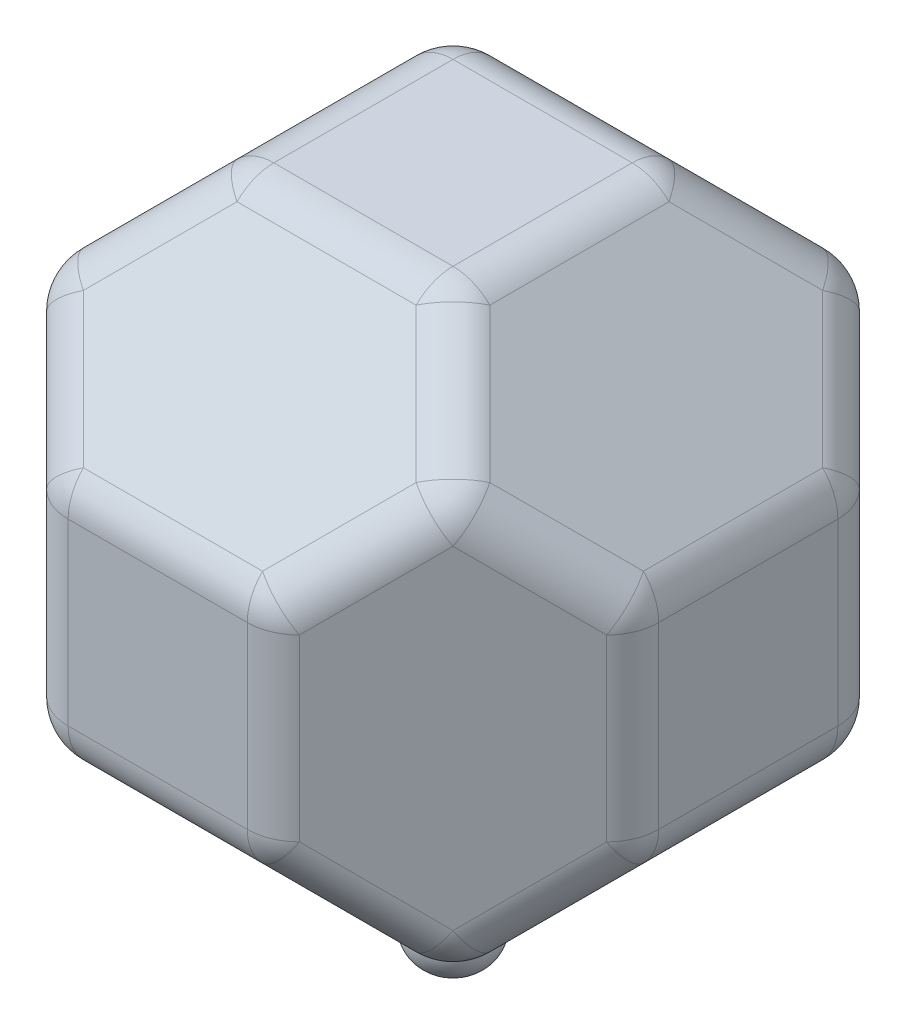
from build123d import *

# Parameters (mm, degrees)
BOSS_EXTRU_1_DEPTH            = 170
ENL_V_MAT_EXTRU_1_DEPTH       = 220
ENL_V_MAT_EXTRU_2_DEPTH       = 220
ENL_V_MAT_EXTRU_3_DEPTH       = 220
ENL_V_MAT_EXTRU_4_DEPTH       = 220
ENL_V_MAT_EXTRU_11_DEPTH      = 220
ENL_V_MAT_EXTRU_13_DEPTH      = 220
ENL_V_MAT_EXTRU_13_DEPTH_BACK = 220
ENL_V_MAT_EXTRU_14_DEPTH      = 220
ENL_V_MAT_EXTRU_15_DEPTH      = 220
ENL_V_MAT_EXTRU_15_DEPTH_BACK = 220
ENL_V_MAT_EXTRU_16_DEPTH      = 220
ENL_V_MAT_EXTRU_17_DEPTH      = 220
ENL_V_MAT_EXTRU_17_DEPTH_BACK = 220
ENL_V_MAT_EXTRU_18_DEPTH      = 220
ENL_V_MAT_EXTRU_19_DEPTH      = 220
ENL_V_MAT_EXTRU_19_DEPTH_BACK = 220
ENL_V_MAT_EXTRU_20_DEPTH      = 220
ENL_V_MAT_EXTRU_20_DEPTH_BACK = 220
ENL_V_MAT_EXTRU_21_DEPTH      = 220
ENL_V_MAT_EXTRU_21_DEPTH_BACK = 220
ENL_V_MAT_EXTRU_22_DEPTH      = 220
ENL_V_MAT_EXTRU_22_DEPTH_BACK = 220
ENL_V_MAT_EXTRU_23_DEPTH      = 220
ENL_V_MAT_EXTRU_23_DEPTH_BACK = 220
CONG_2_R                      = 15
ESQUISSE26_R                  = 11.42194069
BOSS_EXTRU_2_DEPTH            = 30
CONG_6_R                      = 10


with BuildPart() as part:
    # Esquisse1 → Boss.-Extru.1 (new body)
    with BuildSketch(Plane.XY):
        Polygon((-32, 85), (32, 85), (85, 32), (85, -32), (32, -85), (-32, -85), (-85, -32), (-85, 32), align=None)
    extrude(amount=BOSS_EXTRU_1_DEPTH)

    # Esquisse3D3 → Enlèv. mat.-Extru.1 (cut, along a direction that is not the sketch's normal)
    with BuildSketch(Plane(origin=(-32, 85, 117), x_dir=(0.6493531093113899, -0.5377455436484948, 0.5377455436484945), z_dir=(0, 0.7071067811865474, 0.7071067811865478))):
        Polygon((0, 0), (57.001027627, -48.67117062), (98.559626623, 0), (41.558598996, 48.67117062), align=None)
    extrude(amount=ENL_V_MAT_EXTRU_1_DEPTH, dir=(0, 0, 1), mode=Mode.SUBTRACT)

    # Esquisse3D4 → Enlèv. mat.-Extru.2 (cut, along a direction that is not the sketch's normal)
    with BuildSketch(Plane(origin=(32, 85, 53), x_dir=(-0.6493531093113893, -0.537745543648495, -0.537745543648495), z_dir=(0, -0.7071067811865476, 0.7071067811865476))):
        Polygon((0, 0), (57.001027627, 48.67117062), (98.559626623, 0), (41.558598996, -48.67117062), align=None)
    extrude(amount=-ENL_V_MAT_EXTRU_2_DEPTH, dir=(0, 0, 1), mode=Mode.SUBTRACT)

    # Esquisse3D5 → Enlèv. mat.-Extru.3 (cut, along a direction that is not the sketch's normal)
    with BuildSketch(Plane(origin=(-32, -85, 53), x_dir=(0.6493531093113899, 0.5377455436484946, -0.5377455436484948), z_dir=(0, 0.7071067811865479, 0.7071067811865472))):
        Polygon((0, 0), (57.001027627, 48.67117062), (98.559626623, 0), (41.558598996, -48.67117062), align=None)
    extrude(amount=-ENL_V_MAT_EXTRU_3_DEPTH, dir=(0, 0, 1), mode=Mode.SUBTRACT)

    # Esquisse3D6 → Enlèv. mat.-Extru.4 (cut, along a direction that is not the sketch's normal)
    with BuildSketch(Plane(origin=(32, -85, 117), x_dir=(-0.6493531093113899, 0.5377455436484946, 0.5377455436484947), z_dir=(0, 0.7071067811865476, -0.7071067811865476))):
        Polygon((0, 0), (57.001027627, 48.67117062), (98.559626623, 0), (41.558598996, -48.67117062), align=None)
    extrude(amount=-ENL_V_MAT_EXTRU_4_DEPTH, dir=(0, 0, -1), mode=Mode.SUBTRACT)

    # Esquisse3D13 → Enlèv. mat.-Extru.11 (cut, along a direction that is not the sketch's normal)
    with BuildSketch(Plane(origin=(32, 32, 170), x_dir=(0.5377455436484943, -0.6493531093113897, -0.5377455436484953), z_dir=(-0.7071067811865481, 0, -0.7071067811865469))):
        Polygon((0, 0), (57.001027627, -48.67117062), (98.559626623, 0), (41.558598996, 48.67117062), align=None)
    extrude(amount=-ENL_V_MAT_EXTRU_11_DEPTH, dir=(-1, 0, 0), mode=Mode.SUBTRACT)

    # Esquisse16 → Enlèv. mat.-Extru.13 (cut, two sides: drawn at the far end of the back side and taken through both)
    with BuildSketch(Plane(origin=(0, -32, 0), x_dir=(1, 0, 0), z_dir=(0, 1, 0)).offset(-ENL_V_MAT_EXTRU_13_DEPTH_BACK)):
        Polygon((32, -170), (85, -170), (85, -117), align=None)
    extrude(amount=ENL_V_MAT_EXTRU_13_DEPTH + ENL_V_MAT_EXTRU_13_DEPTH_BACK, mode=Mode.SUBTRACT)

    # Esquisse3D15 → Enlèv. mat.-Extru.14 (cut, along a direction that is not the sketch's normal)
    with BuildSketch(Plane(origin=(-85, -32, 117), x_dir=(0.5377455436484945, 0.6493531093113897, 0.5377455436484953), z_dir=(0.707106781186548, 0, -0.707106781186547))):
        Polygon((0, 0), (57.001027627, 48.67117062), (98.559626623, 0), (41.558598996, -48.67117062), align=None)
    extrude(amount=-ENL_V_MAT_EXTRU_14_DEPTH, dir=(0, 0, -1), mode=Mode.SUBTRACT)

    # Esquisse17 → Enlèv. mat.-Extru.15 (cut, two sides: drawn at the far end of the back side and taken through both)
    with BuildSketch(Plane(origin=(0, -32, 0), x_dir=(1, 0, 0), z_dir=(0, 1, 0)).offset(-ENL_V_MAT_EXTRU_15_DEPTH_BACK)):
        Polygon((-85, -117), (-32, -170), (-85, -170), align=None)
    extrude(amount=ENL_V_MAT_EXTRU_15_DEPTH + ENL_V_MAT_EXTRU_15_DEPTH_BACK, mode=Mode.SUBTRACT)

    # Esquisse3D16 → Enlèv. mat.-Extru.16 (cut, along a direction that is not the sketch's normal)
    with BuildSketch(Plane(origin=(-32, 32, 0), x_dir=(-0.5377455436484945, -0.6493531093113896, 0.5377455436484951), z_dir=(0.7071067811865479, 0, 0.7071067811865471))):
        Polygon((0, 0), (57.001027627, -48.67117062), (98.559626623, 0), (41.558598996, 48.67117062), align=None)
    extrude(amount=-ENL_V_MAT_EXTRU_16_DEPTH, dir=(0, 0, 1), mode=Mode.SUBTRACT)

    # Esquisse18 → Enlèv. mat.-Extru.17 (cut, two sides: drawn at the far end of the back side and taken through both)
    with BuildSketch(Plane(origin=(0, -32, 0), x_dir=(1, 0, 0), z_dir=(0, 1, 0)).offset(-ENL_V_MAT_EXTRU_17_DEPTH_BACK)):
        Polygon((-32, 0), (-85, -53), (-85, 0), align=None)
    extrude(amount=ENL_V_MAT_EXTRU_17_DEPTH + ENL_V_MAT_EXTRU_17_DEPTH_BACK, mode=Mode.SUBTRACT)

    # Esquisse3D17 → Enlèv. mat.-Extru.18 (cut, along a direction that is not the sketch's normal)
    with BuildSketch(Plane(origin=(85, 32, 53), x_dir=(-0.5377455436484941, -0.6493531093113903, -0.5377455436484949), z_dir=(0.707106781186548, 0, -0.707106781186547))):
        Polygon((0, 0), (57.001027627, 48.67117062), (98.559626623, 0), (41.558598996, -48.67117062), align=None)
    extrude(amount=ENL_V_MAT_EXTRU_18_DEPTH, dir=(0, 0, -1), mode=Mode.SUBTRACT)

    # Esquisse19 → Enlèv. mat.-Extru.19 (cut, two sides: drawn at the far end of the back side and taken through both)
    with BuildSketch(Plane(origin=(0, -32, 0), x_dir=(1, 0, 0), z_dir=(0, 1, 0)).offset(-ENL_V_MAT_EXTRU_19_DEPTH_BACK)):
        Polygon((85, -53), (32, 0), (85, 0), align=None)
    extrude(amount=ENL_V_MAT_EXTRU_19_DEPTH + ENL_V_MAT_EXTRU_19_DEPTH_BACK, mode=Mode.SUBTRACT)

    # Esquisse21 → Enlèv. mat.-Extru.20 (cut, two sides: drawn at the far end of the back side and taken through both)
    with BuildSketch(Plane.ZY.offset(-32).offset(-ENL_V_MAT_EXTRU_20_DEPTH_BACK)):
        Polygon((117, 85), (170, 32), (170, 85), align=None)
    extrude(amount=ENL_V_MAT_EXTRU_20_DEPTH + ENL_V_MAT_EXTRU_20_DEPTH_BACK, mode=Mode.SUBTRACT)

    # Esquisse23 → Enlèv. mat.-Extru.21 (cut, two sides: drawn at the far end of the back side and taken through both)
    with BuildSketch(Plane.ZY.offset(-32).offset(-ENL_V_MAT_EXTRU_21_DEPTH_BACK)):
        Polygon((0, 32), (53, 85), (0, 85), align=None)
    extrude(amount=ENL_V_MAT_EXTRU_21_DEPTH + ENL_V_MAT_EXTRU_21_DEPTH_BACK, mode=Mode.SUBTRACT)

    # Esquisse24 → Enlèv. mat.-Extru.22 (cut, two sides: drawn at the far end of the back side and taken through both)
    with BuildSketch(Plane.ZY.offset(-32).offset(-ENL_V_MAT_EXTRU_22_DEPTH_BACK)):
        Polygon((0, -32), (53, -85), (0, -85), align=None)
    extrude(amount=ENL_V_MAT_EXTRU_22_DEPTH + ENL_V_MAT_EXTRU_22_DEPTH_BACK, mode=Mode.SUBTRACT)

    # Esquisse25 → Enlèv. mat.-Extru.23 (cut, two sides: drawn at the far end of the back side and taken through both)
    with BuildSketch(Plane(origin=(-32, 0, 0), x_dir=(0, 0, -1), z_dir=(1, 0, 0)).offset(-ENL_V_MAT_EXTRU_23_DEPTH_BACK)):
        Polygon((-170, -32), (-170, -85), (-117, -85), align=None)
    extrude(amount=ENL_V_MAT_EXTRU_23_DEPTH + ENL_V_MAT_EXTRU_23_DEPTH_BACK, mode=Mode.SUBTRACT)

    # Congé2
    cong_2_edges = [part.edges().sort_by_distance(p)[0] for p in [
        (85, 32, 85),
        (85, -32, 85),
        (32, 0, 170),
        (85, 0, 117),
        (71.75, 45.25, 130.25),
        (-85, -32, 85),
        (-85, 32, 85),
        (-32, 0, 170),
        (-85, 0, 117),
        (-71.75, -45.25, 130.25),
        (-32, 0, 0),
        (-85, 0, 53),
        (-71.75, 45.25, 39.75),
        (85, 0, 53),
        (32, 0, 0),
        (71.75, -45.25, 39.75),
        (-71.75, 45.25, 130.25),
        (-45.25, 45.25, 156.75),
        (-32, 85, 85),
        (45.25, 45.25, 156.75),
        (45.25, 71.75, 130.25),
        (-45.25, 71.75, 130.25),
        (32, 85, 85),
        (71.75, 45.25, 39.75),
        (45.25, 45.25, 13.25),
        (-45.25, 45.25, 13.25),
        (-45.25, 71.75, 39.75),
        (45.25, 71.75, 39.75),
        (-71.75, -45.25, 39.75),
        (0, 32, 170),
        (-45.25, -71.75, 39.75),
        (-45.25, -45.25, 13.25),
        (45.25, -71.75, 39.75),
        (45.25, -45.25, 13.25),
        (0, 85, 117),
        (71.75, -45.25, 130.25),
        (-45.25, -45.25, 156.75),
        (-45.25, -71.75, 130.25),
        (45.25, -45.25, 156.75),
        (45.25, -71.75, 130.25),
        (0, 85, 53),
        (0, 32, 0),
        (0, -85, 53),
        (0, -32, 0),
        (32, -85, 85),
        (-32, -85, 85),
        (0, -32, 170),
        (0, -85, 117),
    ]]
    fillet(cong_2_edges, radius=CONG_2_R)

    # Esquisse26 → Boss.-Extru.2 (add)
    with BuildSketch(Plane.XZ.offset(85)):
        with Locations(Location((0, 85, 0), (0, 0, 180))):
            Circle(ESQUISSE26_R)
    extrude(amount=BOSS_EXTRU_2_DEPTH)

    # Congé6
    cong_6_edges = [part.edges().sort_by_distance(p)[0] for p in [
        (11.42194069, -115, 85),
    ]]
    fillet(cong_6_edges, radius=CONG_6_R)


solid = part.part
